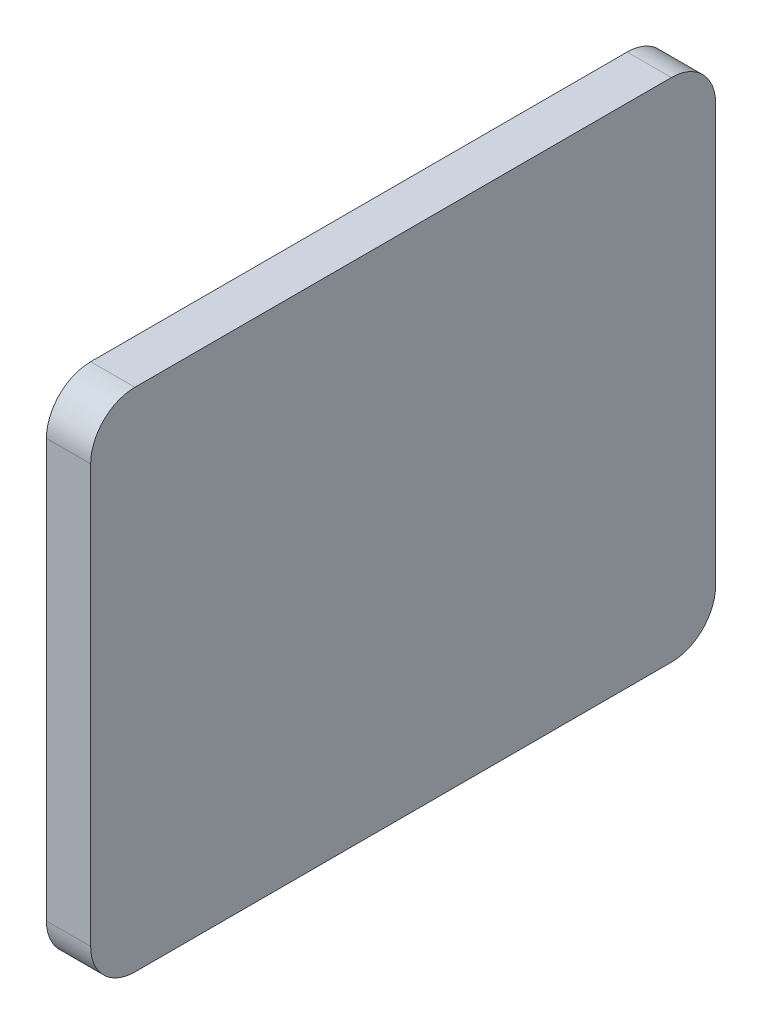
from build123d import *

# Parameters (mm, degrees)
BOSS_EXTRUDE1_DEPTH  = 10
SKETCH2_W            = 126.239695514
SKETCH2_H            = 23.85134482
BOSS_EXTRUDE2_DEPTH  = 1
SKETCH3_W            = 86.620822065
SKETCH3_H            = 40.480960521
CUT_EXTRUDE1_DEPTH   = 1
BOSS_EXTRUDE3_DEPTH  = 1
CUT_EXTRUDE2_DEPTH   = 1
CUT_EXTRUDE3_DEPTH   = 1
SKETCH7_R            = 5.818355016
BOSS_EXTRUDE4_DEPTH  = 1
CUT_EXTRUDE4_DEPTH   = 1
SKETCH9_W            = 82.966205678
SKETCH9_H            = 36.690096102
BOSS_EXTRUDE5_DEPTH  = 1
SKETCH10_R           = 6.400347528
SKETCH10_R_2         = 6.256537277
SKETCH10_R_3         = 5.792934021
BOSS_EXTRUDE6_DEPTH  = 1
SKETCH11_W           = 2.972815209
SKETCH11_H           = 2.098016172
SKETCH11_W_2         = 3.082053364
SKETCH11_H_2         = 2.241881155
SKETCH11_H_3         = 2.474260873
SKETCH11_H_4         = 2.518530518
SKETCH11_H_5         = 2.343405132
SKETCH11_H_6         = 2.518158481
SKETCH11_H_7         = 2.098016173
SKETCH11_W_3         = 3.131856642
SKETCH11_H_8         = 2.122144669
SKETCH11_W_4         = 3.394411057
SKETCH11_W_5         = 2.971426273
SKETCH11_H_9         = 2.664213431
SKETCH11_H_10        = 2.459561983
SKETCH11_H_11        = 2.241443452
SKETCH11_W_6         = 2.778133759
SKETCH11_W_7         = 2.875565616
BOSS_EXTRUDE8_DEPTH  = 1
SKETCH12_W           = 35.56520105
SKETCH12_H           = 29.669607801
SKETCH12_W_2         = 33.753935441
SKETCH12_H_2         = 28.2976837
BOSS_EXTRUDE9_DEPTH  = 1
SKETCH13_W           = 10.514386539
SKETCH13_H           = 5.002968311
SKETCH13_W_2         = 0.95750902
SKETCH13_H_2         = 1.954465522
CUT_EXTRUDE5_DEPTH   = 1
SKETCH14_W           = 1.786282743
SKETCH14_H           = 4.118857823
SKETCH14_W_2         = 1.653370189
SKETCH14_W_3         = 1.521430695
SKETCH14_W_4         = 1.467876451
BOSS_EXTRUDE10_DEPTH = 1
SKETCH15_W           = 1.666288099
SKETCH15_H           = 5.544986266
SKETCH15_W_2         = 1.446679648
SKETCH15_H_2         = 4.553639449
SKETCH15_W_3         = 1.31320449
SKETCH15_H_3         = 3.432434778
SKETCH15_W_4         = 1.051822198
SKETCH15_H_4         = 1.716217389
CUT_EXTRUDE6_DEPTH   = 1
BOSS_EXTRUDE12_DEPTH = 1
SKETCH17_W           = 80.557571146
SKETCH17_H           = 4.898658791
BOSS_EXTRUDE13_DEPTH = 1
CUT_EXTRUDE7_DEPTH   = 1
BOSS_EXTRUDE14_DEPTH = 1


with BuildPart() as part:
    # Sketch1 → Boss-Extrude1 (new body)
    with BuildSketch(Plane(origin=(0, 0, 0), x_dir=(0, 0, -1), z_dir=(1, 0, 0))):
        with BuildLine():
            Line((10, 0), (131.29221645, 0))
            ThreePointArc((131.29221645, 0), (138.363284262, -2.928932188), (141.29221645, -10))
            Line((141.29221645, -10), (141.29221645, -104.488481637))
            ThreePointArc((141.29221645, -104.488481637), (138.363284262, -111.559549449), (131.29221645, -114.488481637))
            Line((131.29221645, -114.488481637), (10, -114.488481637))
            ThreePointArc((10, -114.488481637), (2.928932188, -111.559549449), (0, -104.488481637))
            Line((0, -104.488481637), (0, -10))
            ThreePointArc((0, -10), (2.928932188, -2.928932188), (10, 0))
        make_face()
    extrude(amount=BOSS_EXTRUDE1_DEPTH)

    # Sketch2 → Boss-Extrude2 (add)
    with BuildSketch(Plane.ZY):
        with Locations((-72.897654169, -99.510171093)):
            Rectangle(SKETCH2_W, SKETCH2_H)
    extrude(amount=BOSS_EXTRUDE2_DEPTH)

    # Sketch3 → Cut-Extrude1 (cut)
    with BuildSketch(Plane.ZY):
        with Locations((-51.830913775, -28.699166059)):
            Rectangle(SKETCH3_W, SKETCH3_H)
    extrude(amount=-CUT_EXTRUDE1_DEPTH, mode=Mode.SUBTRACT)

    # Sketch4 → Boss-Extrude3 (add)
    with BuildSketch(Plane.ZY):
        with BuildLine():
            ThreePointArc((-128.790885947, -24.915612321), (-130.520517638, -31.55317783), (-127.589714053, -37.754733443))
            Line((-127.589714053, -37.754733443), (-130.555100632, -42.50282147))
            ThreePointArc((-130.555100632, -42.50282147), (-136.029645631, -31.778694208), (-132.213086119, -20.358912162))
            Line((-132.213086119, -20.358912162), (-128.790885947, -24.915612321))
        make_face()
        with BuildLine():
            ThreePointArc((-111.988177066, -17.599338504), (-121.337359121, -15.078404834), (-130.367202959, -18.574721742))
            Line((-130.367202959, -18.574721742), (-126.849675404, -22.814610434))
            ThreePointArc((-126.849675404, -22.814610434), (-121.05291072, -20.579923319), (-115.049784903, -22.179544437))
            Line((-115.049784903, -22.179544437), (-111.988177066, -17.599338504))
        make_face()
        with BuildLine():
            Line((-112.779176464, -37.037545755), (-109.333185582, -41.440132956))
            ThreePointArc((-109.333185582, -41.440132956), (-104.973356341, -29.809019004), (-110.515797356, -18.692712497))
            Line((-110.515797356, -18.692712497), (-113.323727459, -23.591874847))
            ThreePointArc((-113.323727459, -23.591874847), (-110.469462865, -30.210139489), (-112.779176464, -37.037545755))
        make_face()
        with BuildLine():
            Line((-126.220268741, -38.890736425), (-129.282262794, -43.471520144))
            ThreePointArc((-129.282262794, -43.471520144), (-119.730349774, -46.157565443), (-110.496942156, -42.525239516))
            Line((-110.496942156, -42.525239516), (-110.515797356, -42.50282147))
            Line((-110.515797356, -42.50282147), (-114.014620837, -38.28547793))
            ThreePointArc((-114.014620837, -38.28547793), (-120.014898722, -40.656052023), (-126.220268741, -38.890736425))
        make_face()
    extrude(amount=BOSS_EXTRUDE3_DEPTH)

    # Sketch5 → Cut-Extrude2 (cut)
    with BuildSketch(Plane.ZY.offset(1)):
        Polygon((-122.657270122, -19.344939874), (-119.289111123, -19.344939874), (-120.973190623, -16.174627983), align=None)
    extrude(amount=-CUT_EXTRUDE2_DEPTH, mode=Mode.SUBTRACT)

    # Sketch6 → Cut-Extrude3 (cut)
    with BuildSketch(Plane.ZY.offset(1)):
        Polygon((-132.046053487, -29.687022904), (-132.046053487, -33.102725716), (-135.44917165, -31.39487431), align=None)
        Polygon((-122.572384305, -41.734659995), (-118.459361538, -41.734659995), (-120.515872921, -44.766345306), align=None)
        Polygon((-109.677294693, -28.717998168), (-109.677294693, -32.69802994), (-106.110153536, -30.278297797), align=None)
    extrude(amount=-CUT_EXTRUDE3_DEPTH, mode=Mode.SUBTRACT)

    # Sketch7 → Boss-Extrude4 (add)
    with BuildSketch(Plane.ZY):
        with Locations(Location((-120.761056711, -31.140518652, 0), (0, 0, 180))):
            Circle(SKETCH7_R)
    extrude(amount=BOSS_EXTRUDE4_DEPTH)

    # Sketch8 → Cut-Extrude4 (cut)
    with BuildSketch(Plane.ZY.offset(1)):
        with BuildLine():
            Line((-121.176346617, -28.997764831), (-120.443515779, -28.997764831))
            Line((-120.443515779, -28.997764831), (-120.443515779, -33.464729922))
            ThreePointArc((-120.443515779, -33.464729922), (-119.430454809, -32.340956398), (-119.97042264, -30.927593669))
            Line((-119.97042264, -30.927593669), (-119.785806048, -30.215447507))
            ThreePointArc((-119.785806048, -30.215447507), (-120.854922729, -34.220615596), (-121.924039409, -30.215447507))
            Line((-121.924039409, -30.215447507), (-121.682006241, -30.885552228))
            ThreePointArc((-121.682006241, -30.885552228), (-122.277151809, -32.352694211), (-121.174353339, -33.488713305))
            Line((-121.174353339, -33.488713305), (-121.176346617, -28.997764831))
        make_face()
    extrude(amount=-CUT_EXTRUDE4_DEPTH, mode=Mode.SUBTRACT)

    # Sketch9 → Boss-Extrude5 (add)
    with BuildSketch(Plane.ZY.offset(-1)):
        with Locations((-51.794853588, -28.849329879)):
            Rectangle(SKETCH9_W, SKETCH9_H)
    extrude(amount=BOSS_EXTRUDE5_DEPTH)

    # Sketch10 → Boss-Extrude6 (add)
    with BuildSketch(Plane.ZY):
        with Locations(Location((-85.81960438, -69.14588858, 0), (0, 0, 180))):
            Circle(SKETCH10_R)
        with Locations(Location((-60.871881496, -69.14588858, 0), (0, 0, 180))):
            Circle(SKETCH10_R_2)
        with Locations(Location((-37.878420509, -69.14588858, 0), (0, 0, 180))):
            Circle(SKETCH10_R_3)
    extrude(amount=BOSS_EXTRUDE6_DEPTH)

    # Sketch11 → Boss-Extrude8 (add)
    with BuildSketch(Plane.ZY):
        with Locations((-129.116857762, -57.712220893)):
            Rectangle(SKETCH11_W, SKETCH11_H)
        with Locations((-129.17147684, -62.042220354)):
            Rectangle(SKETCH11_W_2, SKETCH11_H_2)
        with Locations((-129.17147684, -66.705685923)):
            Rectangle(SKETCH11_W_2, SKETCH11_H_3)
        with Locations((-129.17147684, -71.689456814)):
            Rectangle(SKETCH11_W_2, SKETCH11_H_4)
        with Locations((-129.17147684, -76.781995127)):
            Rectangle(SKETCH11_W_2, SKETCH11_H_5)
        with Locations((-123.513102307, -80.655445415)):
            Rectangle(SKETCH11_W, SKETCH11_H_6)
        with Locations((-123.513102307, -76.781995127)):
            Rectangle(SKETCH11_W, SKETCH11_H_5)
        with Locations((-123.513102307, -71.689456814)):
            Rectangle(SKETCH11_W, SKETCH11_H_4)
        with Locations((-123.513102307, -66.705685923)):
            Rectangle(SKETCH11_W, SKETCH11_H_3)
        with Locations((-123.513102307, -62.042220354)):
            Rectangle(SKETCH11_W, SKETCH11_H_2)
        with Locations((-123.513102307, -57.812773593)):
            Rectangle(SKETCH11_W, SKETCH11_H_7)
        with Locations((-118.010018245, -57.824837841)):
            Rectangle(SKETCH11_W_3, SKETCH11_H_8)
        with Locations((-118.010018245, -62.042220354)):
            Rectangle(SKETCH11_W_3, SKETCH11_H_2)
        with Locations((-117.878741038, -66.705685923)):
            Rectangle(SKETCH11_W_4, SKETCH11_H_3)
        with Locations((-118.010018245, -71.689456814)):
            Rectangle(SKETCH11_W_3, SKETCH11_H_4)
        with Locations((-118.010018245, -76.781995127)):
            Rectangle(SKETCH11_W_3, SKETCH11_H_5)
        with Locations((-118.010018245, -80.655445415)):
            Rectangle(SKETCH11_W_3, SKETCH11_H_6)
        with Locations((-112.726545133, -80.72847289)):
            Rectangle(SKETCH11_W_5, SKETCH11_H_9)
        with Locations((-112.726545133, -76.723916702)):
            Rectangle(SKETCH11_W_5, SKETCH11_H_10)
        with Locations((-112.726545133, -71.689456814)):
            Rectangle(SKETCH11_W_5, SKETCH11_H_4)
        with Locations((-112.726545133, -62.042220354)):
            Rectangle(SKETCH11_W_5, SKETCH11_H_2)
        with Locations((-112.726545133, -57.884487232)):
            Rectangle(SKETCH11_W_5, SKETCH11_H_11)
        with Locations((-107.183664244, -57.884487232)):
            Rectangle(SKETCH11_W_6, SKETCH11_H_11)
        with Locations((-107.183664244, -62.042220354)):
            Rectangle(SKETCH11_W_6, SKETCH11_H_2)
        with Locations((-107.183664244, -66.705685923)):
            Rectangle(SKETCH11_W_6, SKETCH11_H_3)
        with Locations((-107.183664244, -71.689456814)):
            Rectangle(SKETCH11_W_6, SKETCH11_H_4)
        with Locations((-107.183664244, -76.723916702)):
            Rectangle(SKETCH11_W_6, SKETCH11_H_10)
        with Locations((-107.183664244, -80.72847289)):
            Rectangle(SKETCH11_W_6, SKETCH11_H_9)
        with Locations((-101.890621622, -80.72847289)):
            Rectangle(SKETCH11_W_7, SKETCH11_H_9)
        with Locations((-101.890621622, -76.723916702)):
            Rectangle(SKETCH11_W_7, SKETCH11_H_10)
        with Locations((-101.890621622, -71.689456814)):
            Rectangle(SKETCH11_W_7, SKETCH11_H_4)
        with Locations((-101.890621622, -66.705685923)):
            Rectangle(SKETCH11_W_7, SKETCH11_H_3)
        with Locations((-101.890621622, -62.042220354)):
            Rectangle(SKETCH11_W_7, SKETCH11_H_2)
        with Locations((-101.890621622, -57.884487232)):
            Rectangle(SKETCH11_W_7, SKETCH11_H_11)
        with Locations((-129.17147684, -80.655445415)):
            Rectangle(SKETCH11_W_2, SKETCH11_H_6)
        with Locations((-112.726545133, -66.705685923)):
            Rectangle(SKETCH11_W_5, SKETCH11_H_3)
    extrude(amount=BOSS_EXTRUDE8_DEPTH)

    # Sketch12 → Boss-Extrude9 (add)
    with BuildSketch(Plane.ZY):
        with Locations((-115.458103044, -69.531212347)):
            Rectangle(SKETCH12_W, SKETCH12_H)
        with Locations((-115.55330476, -69.507694815)):
            Rectangle(SKETCH12_W_2, SKETCH12_H_2, mode=Mode.SUBTRACT)
    extrude(amount=BOSS_EXTRUDE9_DEPTH)

    # Sketch13 → Cut-Extrude5 (cut)
    with BuildSketch(Plane.ZY):
        with Locations((-85.762210127, -15.268648721)):
            Rectangle(SKETCH13_W, SKETCH13_H)
        with Locations((-80.026262347, -15.218032153)):
            Rectangle(SKETCH13_W_2, SKETCH13_H_2)
    extrude(amount=-CUT_EXTRUDE5_DEPTH, mode=Mode.SUBTRACT)

    # Sketch14 → Boss-Extrude10 (add)
    with BuildSketch(Plane.ZY.offset(-1)):
        with Locations((-89.482975331, -15.309369627)):
            Rectangle(SKETCH14_W, SKETCH14_H)
        with Locations((-86.819745715, -15.309369627)):
            Rectangle(SKETCH14_W_2, SKETCH14_H)
        with Locations((-84.553933179, -15.309369627)):
            Rectangle(SKETCH14_W_3, SKETCH14_H)
        with Locations((-82.142653579, -15.309369627)):
            Rectangle(SKETCH14_W_4, SKETCH14_H)
    extrude(amount=BOSS_EXTRUDE10_DEPTH)

    # Sketch15 → Cut-Extrude6 (cut)
    with BuildSketch(Plane.ZY):
        with Locations((-75.2337965, -15.364129694)):
            Rectangle(SKETCH15_W, SKETCH15_H)
        with Locations((-72.689572877, -15.859803103)):
            Rectangle(SKETCH15_W_2, SKETCH15_H_2)
        with Locations((-70.015009255, -16.420405438)):
            Rectangle(SKETCH15_W_3, SKETCH15_H_3)
        with Locations((-67.731413365, -17.278514132)):
            Rectangle(SKETCH15_W_4, SKETCH15_H_4)
    extrude(amount=-CUT_EXTRUDE6_DEPTH, mode=Mode.SUBTRACT)

    # Sketch16 → Boss-Extrude12 (add)
    with BuildSketch(Plane.ZY):
        Polygon((-14.86449256, -12.523044453), (-14.862429197, -15.863207624), (-17.162610633, -14.269536134), (-17.270064576, -15.208767064), (-15.012027999, -16.680542851), (-17.265472303, -17.897624058), (-17.023108249, -18.83170251), (-14.861338776, -17.628376523), (-14.859286076, -20.9512793), (-11.724723968, -18.587871519), (-14.037198038, -16.613435043), (-11.888734391, -14.73693487), align=None)
        Polygon((-14.29785875, -13.672951249), (-14.29785875, -15.90404297), (-12.829586611, -14.788497109), align=None, mode=Mode.SUBTRACT)
        Polygon((-14.378468927, -17.458236682), (-14.378468927, -19.818526141), (-12.758155126, -18.587871519), align=None, mode=Mode.SUBTRACT)
    extrude(amount=BOSS_EXTRUDE12_DEPTH)

    # Sketch17 → Boss-Extrude13 (add)
    with BuildSketch(Plane.ZY):
        with Locations((-52.063427642, -44.580651684)):
            Rectangle(SKETCH17_W, SKETCH17_H)
    extrude(amount=BOSS_EXTRUDE13_DEPTH)

    # Sketch18 → Cut-Extrude7 (cut)
    with BuildSketch(Plane.ZY.offset(1)):
        Polygon((-55.638433508, -46.605188998), (-50.960385932, -46.605188998), (-53.29940972, -43.389026869), align=None)
    extrude(amount=-CUT_EXTRUDE7_DEPTH, mode=Mode.SUBTRACT)

    # Sketch22 → Boss-Extrude14 (add)
    with BuildSketch(Plane.ZY):
        with BuildLine():
            Line((-80.459161169, -28.232742752), (-79.974936077, -28.89519181))
            add(Edge.make_bspline(
                [(-79.974936077, -28.89519181), (-76.235114791, -14.369725598), (-74.763833006, -38.781365648), (-70.341110141, -27.851335154), (-67.485680862, -21.130367322), (-64.89496356, -27.658593829), (-64.37683783, -34.293840305), (-59.81161289, -27.900986658), (-58.169948656, -20.524912007), (-54.137622042, -26.942361166), (-52.558902319, -35.832964719), (-46.924652766, -22.009919816), (-47.676465968, -21.794586414)],
                knots=[0, 0, 0, 0, 0.227693705, 0.30386461, 0.38286511, 0.462183806, 0.522722581, 0.607498596, 0.687606231, 0.778830665, 0.83464475, 1, 1, 1, 1], degree=3))
            Line((-47.676465968, -21.794586414), (-48.203779314, -21.326793481))
            add(Edge.make_bspline(
                [(-80.459161169, -28.232742752), (-76.268444712, -11.029220128), (-74.744996316, -37.520411053), (-70.135058973, -26.27642733), (-67.277624962, -19.526537384), (-64.687353444, -26.06217526), (-64.169365678, -32.695985601), (-59.60294899, -26.302639866), (-57.966116169, -18.930491719), (-53.916280797, -25.333212587), (-52.496810152, -33.732027334), (-47.362650045, -22.404296513), (-48.203779314, -21.326793481)],
                knots=[0, 0, 0, 0, 0.245441013, 0.32175215, 0.400898092, 0.480362817, 0.541013045, 0.625945135, 0.706200251, 0.797592631, 0.853509472, 1, 1, 1, 1], degree=3))
        make_face()
    extrude(amount=BOSS_EXTRUDE14_DEPTH)


solid = part.part
